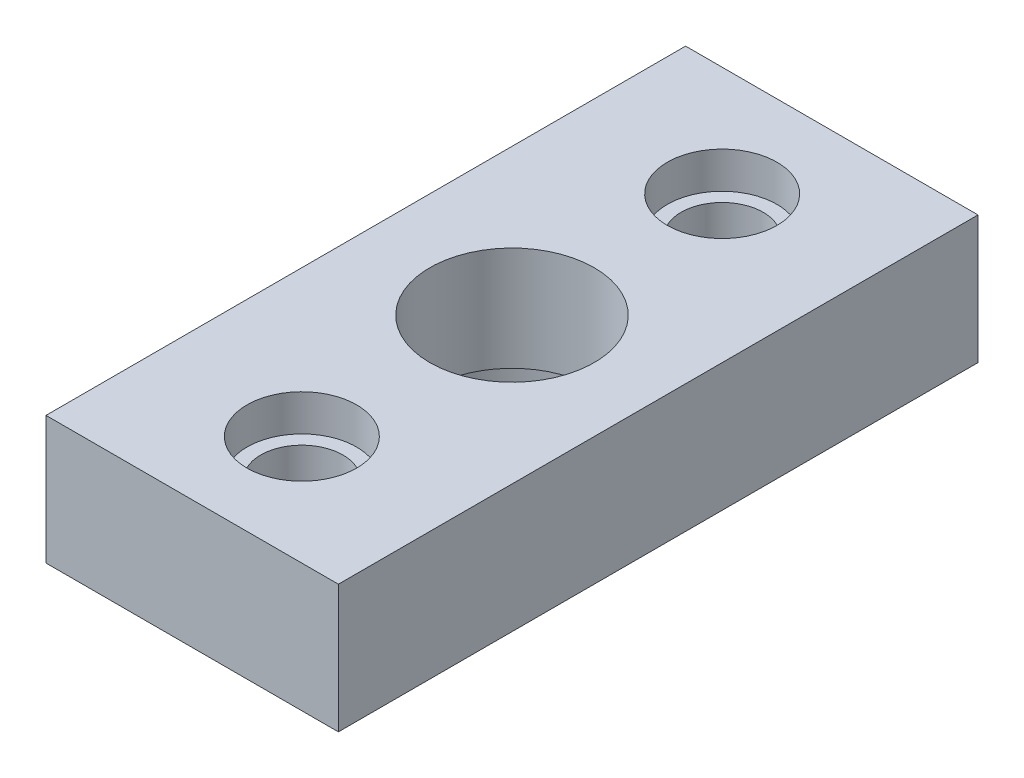
from build123d import *

# Parameters (mm, degrees)
SKETCH_1_W          = 16
SKETCH_1_H          = 35
EXTRUDE_1_DEPTH     = 7
SKETCH_2_R          = 5.35
CUT_EXTRUDE_1_DEPTH = 1.3
SKETCH_3_R          = 4.5
CUT_EXTRUDE_2_DEPTH = 21.068383094
SKETCH_4_R          = 3
CUT_EXTRUDE_3_DEPTH = 2
SKETCH_6_R          = 2.25
CUT_EXTRUDE_4_DEPTH = 20.880895352


with BuildPart() as part:
    # 草图1 → 凸台-拉伸1 (new body)
    with BuildSketch(Plane(origin=(0, 0, 0), x_dir=(1, 0, 0), z_dir=(0, 1, 0))):
        Rectangle(SKETCH_1_W, SKETCH_1_H)
    extrude(amount=EXTRUDE_1_DEPTH)

    # 草图2 → 切除-拉伸1 (cut)
    with BuildSketch(Plane.XZ):
        with Locations(Location((0, 0, 0), (0, 0, 270))):
            Circle(SKETCH_2_R)
    extrude(amount=-CUT_EXTRUDE_1_DEPTH, mode=Mode.SUBTRACT)

    # 草图3 → 切除-拉伸2 (cut, through all)
    with BuildSketch(Plane.XZ.offset(-1.3)):
        with Locations(Location((0, 0, 0), (0, 0, 270))):
            Circle(SKETCH_3_R)
    extrude(amount=-CUT_EXTRUDE_2_DEPTH, mode=Mode.SUBTRACT)

    # 草图4 → 切除-拉伸3 (cut)
    with BuildSketch(Plane(origin=(0, 7, 0), x_dir=(1, 0, 0), z_dir=(0, 1, 0))):
        with Locations(Location((0, 11.5, 0), (0, 0, 270))):
            Circle(SKETCH_4_R)
        with Locations(Location((0, -11.5, 0), (0, 0, 270))):
            Circle(SKETCH_4_R)
    extrude(amount=-CUT_EXTRUDE_3_DEPTH, mode=Mode.SUBTRACT)

    # 草图6 → 切除-拉伸4 (cut, through all)
    with BuildSketch(Plane(origin=(0, 5, 0), x_dir=(1, 0, 0), z_dir=(0, 1, 0))):
        with Locations(Location((0, -11.5, 0), (0, 0, 270))):
            Circle(SKETCH_6_R)
        with Locations(Location((0, 11.5, 0), (0, 0, 270))):
            Circle(SKETCH_6_R)
    extrude(amount=-CUT_EXTRUDE_4_DEPTH, mode=Mode.SUBTRACT)


solid = part.part
